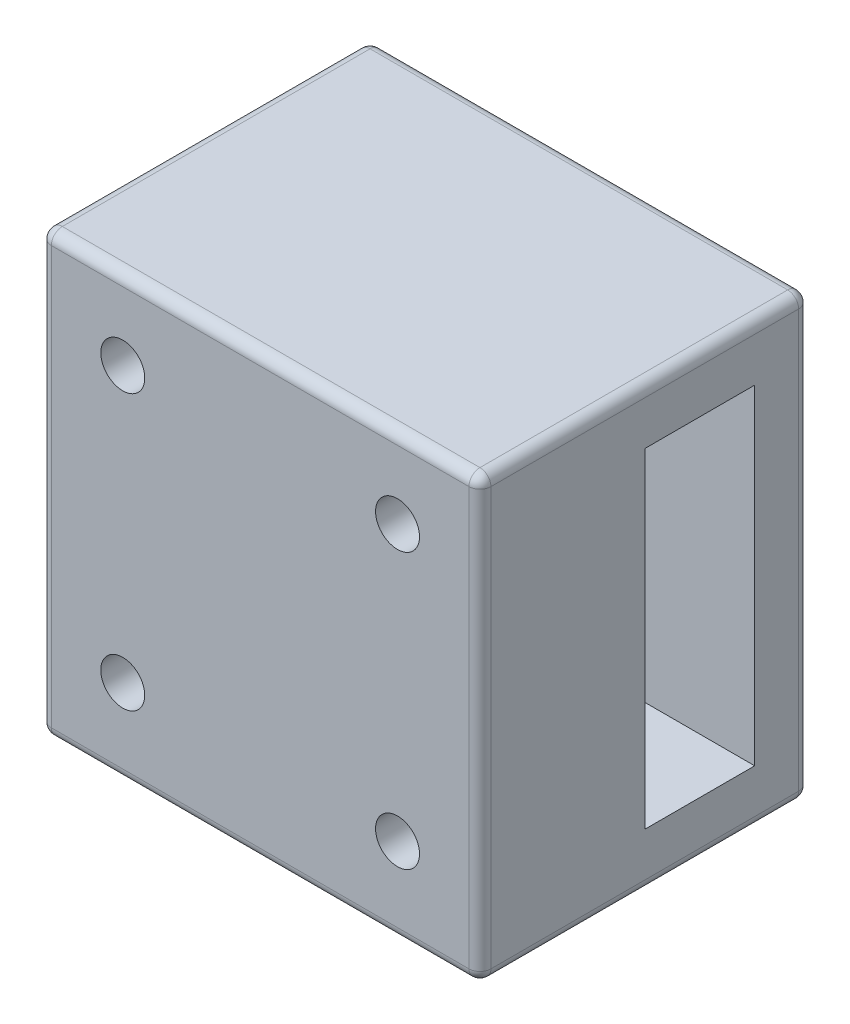
from build123d import *

# Parameters (mm, degrees)
SKETCH2_W           = 40
SKETCH2_H           = 30
BOSS_EXTRUDE1_DEPTH = 40
SKETCH3_W           = 10
SKETCH3_H           = 30
CUT_EXTRUDE1_DEPTH  = 40
CUT_EXTRUDE2_REACH  = 55.852
SKETCH5_R           = 2
FILLET2_R           = 1


with BuildPart() as part:
    # Sketch2 → Boss-Extrude1 (new body)
    with BuildSketch(Plane(origin=(0, 0, 0), x_dir=(1, 0, 0), z_dir=(0, 1, 0))):
        Rectangle(SKETCH2_W, SKETCH2_H)
    extrude(amount=BOSS_EXTRUDE1_DEPTH)

    # Sketch3 → Cut-Extrude1 (cut)
    with BuildSketch(Plane(origin=(20, 0, 0), x_dir=(0, 0, -1), z_dir=(1, 0, 0))):
        with Locations((5, 20)):
            Rectangle(SKETCH3_W, SKETCH3_H)
    extrude(amount=-CUT_EXTRUDE1_DEPTH, mode=Mode.SUBTRACT)

    # Sketch5 → Cut-Extrude2 (cut, up to next)
    with BuildSketch(Plane.XY.offset(15), mode=Mode.PRIVATE) as cut_extrude2_sk1:
        with Locations((12.5, 7.8)):
            Circle(SKETCH5_R)
    cut_extrude2_tool1 = extrude(cut_extrude2_sk1.sketch, amount=-CUT_EXTRUDE2_REACH, mode=Mode.PRIVATE) & part.part
    # Sketch5 → Cut-Extrude2 (cut, up to next)
    with BuildSketch(Plane.XY.offset(15), mode=Mode.PRIVATE) as cut_extrude2_sk2:
        with Locations((12.5, 32.8)):
            Circle(SKETCH5_R)
    cut_extrude2_tool2 = extrude(cut_extrude2_sk2.sketch, amount=-CUT_EXTRUDE2_REACH, mode=Mode.PRIVATE) & part.part
    # Sketch5 → Cut-Extrude2 (cut, up to next)
    with BuildSketch(Plane.XY.offset(15), mode=Mode.PRIVATE) as cut_extrude2_sk3:
        with Locations((-12.5, 32.8)):
            Circle(SKETCH5_R)
    cut_extrude2_tool3 = extrude(cut_extrude2_sk3.sketch, amount=-CUT_EXTRUDE2_REACH, mode=Mode.PRIVATE) & part.part
    # Sketch5 → Cut-Extrude2 (cut, up to next)
    with BuildSketch(Plane.XY.offset(15), mode=Mode.PRIVATE) as cut_extrude2_sk4:
        with Locations((-12.5, 7.8)):
            Circle(SKETCH5_R)
    cut_extrude2_tool4 = extrude(cut_extrude2_sk4.sketch, amount=-CUT_EXTRUDE2_REACH, mode=Mode.PRIVATE) & part.part
    add(cut_extrude2_tool1.solids().sort_by_distance((12.5, 7.8, 15))[0], mode=Mode.SUBTRACT)
    add(cut_extrude2_tool2.solids().sort_by_distance((12.5, 32.8, 15))[0], mode=Mode.SUBTRACT)
    add(cut_extrude2_tool3.solids().sort_by_distance((-12.5, 32.8, 15))[0], mode=Mode.SUBTRACT)
    add(cut_extrude2_tool4.solids().sort_by_distance((-12.5, 7.8, 15))[0], mode=Mode.SUBTRACT)

    # Fillet2
    fillet2_edges = [part.edges().sort_by_distance(p)[0] for p in [
        (20, 40, 0),
        (0, 40, -15),
        (-20, 40, 0),
        (0, 0, -15),
        (20, 0, 0),
        (0, 0, 15),
        (-20, 0, 0),
        (-20, 20, -15),
        (20, 20, -15),
        (20, 20, 15),
        (-20, 20, 15),
        (0, 40, 15),
    ]]
    fillet(fillet2_edges, radius=FILLET2_R)


solid = part.part
